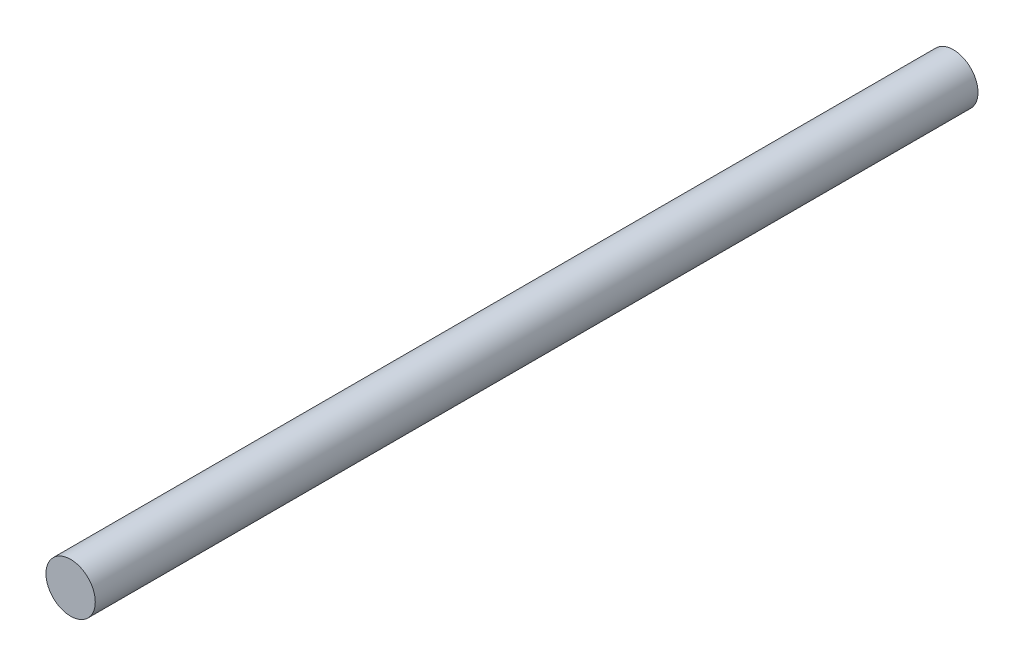
from build123d import *

# Parameters (mm, degrees)
SKETCH1_R           = 4.75
BOSS_EXTRUDE1_DEPTH = 170


with BuildPart() as part:
    # Sketch1 → Boss-Extrude1 (new body)
    with BuildSketch(Plane.XY):
        Circle(SKETCH1_R)
    extrude(amount=BOSS_EXTRUDE1_DEPTH)


solid = part.part
